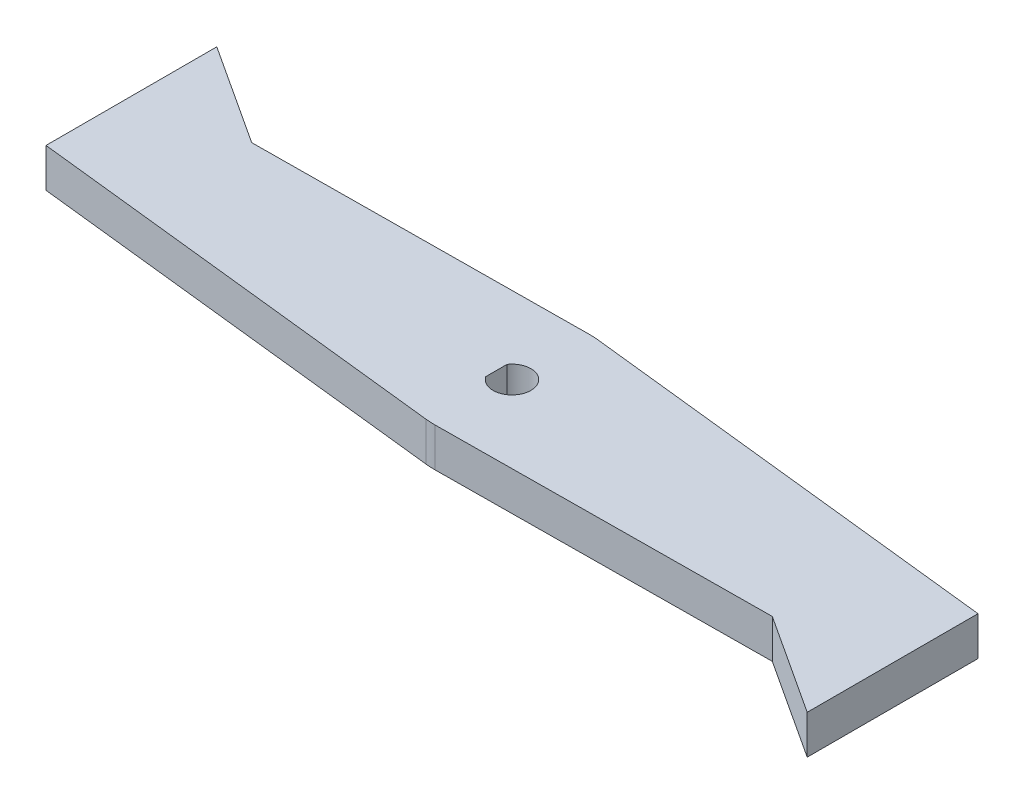
from build123d import *

# Parameters (mm, degrees)
BOSS_EXTRUDE1_DEPTH = 6.35


with BuildPart() as part:
    # Sketch1 → Boss-Extrude1 (new body)
    with BuildSketch(Plane(origin=(0, 0, 0), x_dir=(1, 0, 0), z_dir=(0, 1, 0))):
        with BuildLine():
            Line((71.12, 4.935349186), (71.12, -22.938860698))
            Line((71.12, -22.938860698), (54.725773369, -12.242694437))
            Line((54.725773369, -12.242694437), (0.106224527, -12.699555754))
            ThreePointArc((0.106224527, -12.699555754), (-0.64393835, -12.683664431), (-1.391853504, -12.623499666))
            Line((-1.391853504, -12.623499666), (-71.12, -4.935349186))
            Line((-71.12, -4.935349186), (-71.12, 22.938860698))
            Line((-71.12, 22.938860698), (-54.725773369, 12.242694437))
            Line((-54.725773369, 12.242694437), (-0.106224527, 12.699555754))
            ThreePointArc((-0.106224527, 12.699555754), (0.64393835, 12.683664431), (1.391853504, 12.623499666))
            Line((1.391853504, 12.623499666), (71.12, 4.935349186))
        make_face()
        with BuildLine():
            Line((-2.5527, 1.734282538), (-2.5527, -1.734282538))
            ThreePointArc((-2.5527, -1.734282538), (3.0861, 0), (-2.5527, 1.734282538))
        make_face(mode=Mode.SUBTRACT)
    extrude(amount=BOSS_EXTRUDE1_DEPTH)


solid = part.part
